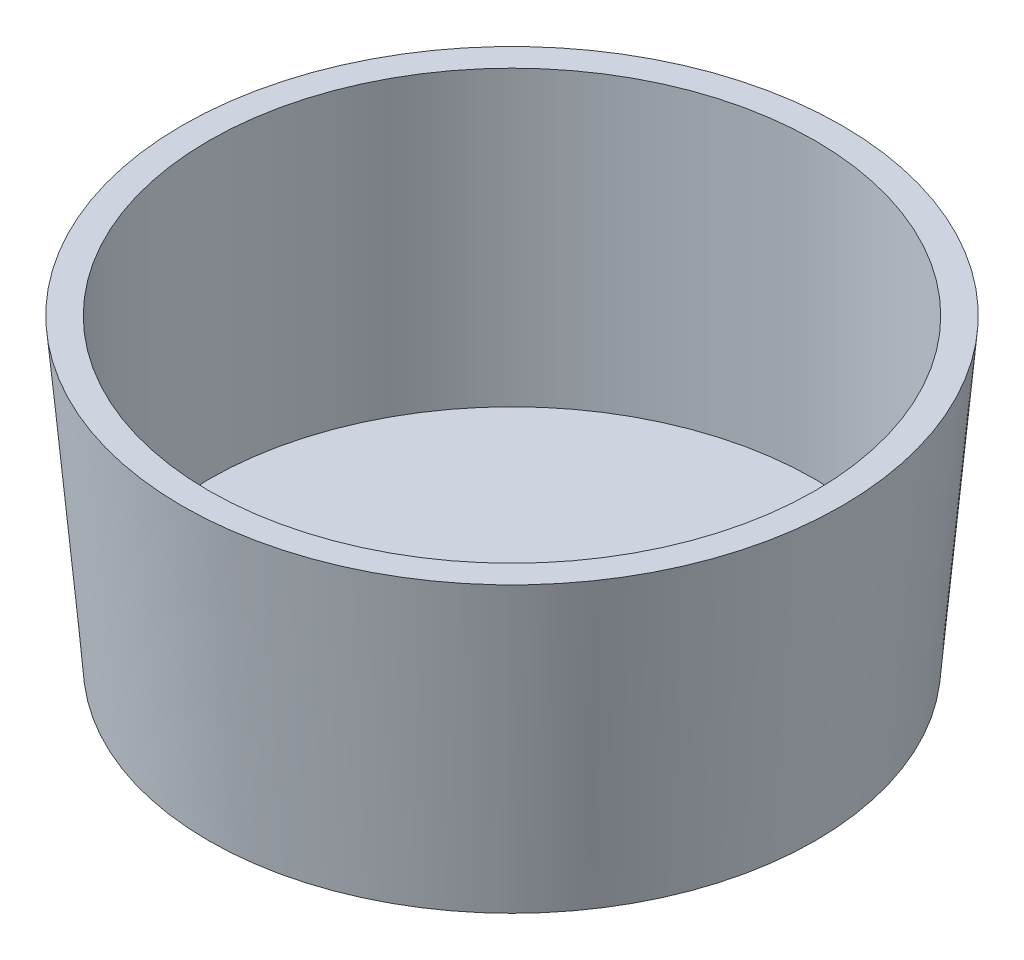
from build123d import *

# Parameters (mm, degrees)
SKETCH1_R           = 152.4
BOSS_EXTRUDE1_DEPTH = 152.4
BOSS_EXTRUDE1_DRAFT = -5
CUT_EXTRUDE2_START  = 5
SKETCH1_3_R         = 152.4
CUT_EXTRUDE2_DEPTH  = 275.572522092


with BuildPart() as part:
    # Sketch1 → Boss-Extrude1 (with draft: the straight prism first)
    with BuildSketch(Plane(origin=(0, 0, 0), x_dir=(1, 0, 0), z_dir=(0, 1, 0))):
        Circle(SKETCH1_R)
    extrude(amount=BOSS_EXTRUDE1_DEPTH)
    # Boss-Extrude1: the draft: its side faces are tilted about the plane it starts from
    boss_extrude1_sides = [part.faces().sort_by_distance(p)[0] for p in [
        (-152.4, 76.2, 0),
    ]]
    draft(boss_extrude1_sides, Plane(origin=(0, 0, 0), x_dir=(1, 0, 0), z_dir=(0, 1, 0)), BOSS_EXTRUDE1_DRAFT)

    # Sketch1<3> → Cut-Extrude2 (cut, through all)
    with BuildSketch(Plane(origin=(0, 0, 0), x_dir=(1, 0, 0), z_dir=(0, 1, 0)).offset(CUT_EXTRUDE2_START)):
        Circle(SKETCH1_3_R)
    extrude(amount=CUT_EXTRUDE2_DEPTH, mode=Mode.SUBTRACT)


solid = part.part
